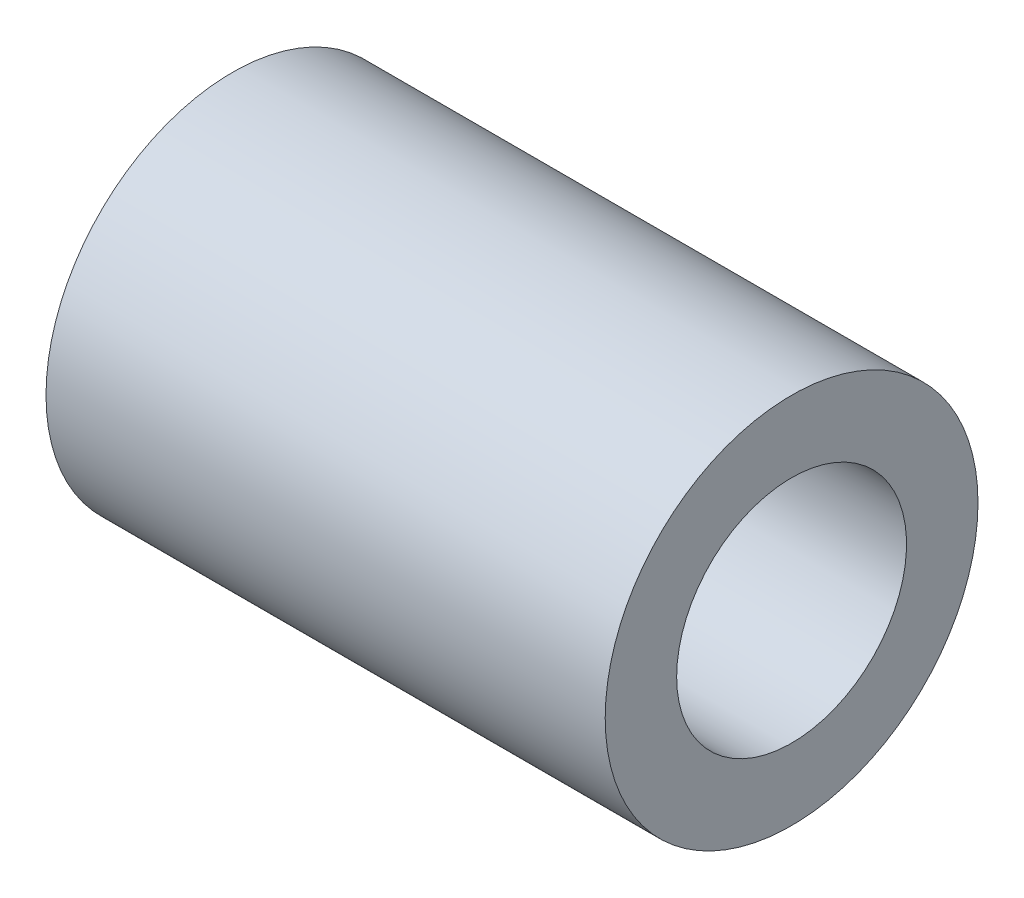
from build123d import *

# Parameters (mm, degrees)
SKETCH1_W = 9
SKETCH1_H = 1.15


with BuildPart() as part:
    # Sketch1 → Revolve1 (revolve)
    with BuildSketch(Plane.XY, mode=Mode.PRIVATE) as revolve1_sk:
        with Locations((4.5, 2.425)):
            Rectangle(SKETCH1_W, SKETCH1_H)
    revolve(revolve1_sk.sketch.rotate(Axis((-1000, 0, 0), (1, 0, 0)), 90), axis=Axis((-1000, 0, 0), (1, 0, 0)))


solid = part.part
